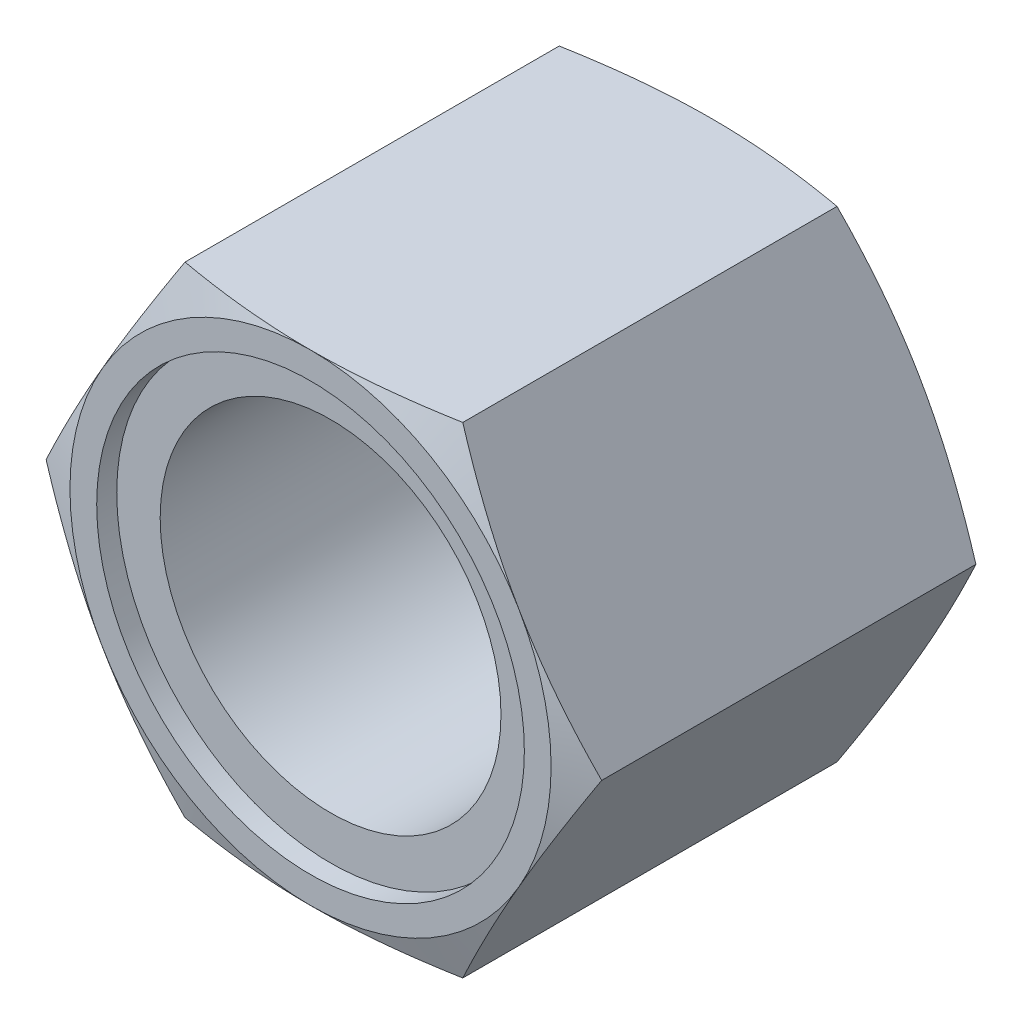
from build123d import *

# Parameters (mm, degrees)
EXTRUDE_1_DEPTH     = 30
SKETCH_2_R          = 12.75
CUT_EXTRUDE_1_DEPTH = 25
SKETCH_3_R          = 13.5
CUT_EXTRUDE_2_DEPTH = 4
SKETCH_4_R          = 16
CUT_EXTRUDE_3_DEPTH = 1.5


with BuildPart() as part:
    # Эскиз1 → Вытянуть1 (new body)
    with BuildSketch(Plane.XY):
        Polygon((10.392304845, 18), (-10.392304845, 18), (-20.784609691, 0), (-10.392304845, -18), (10.392304845, -18), (20.784609691, 0), align=None)
    extrude(amount=EXTRUDE_1_DEPTH)

    # Эскиз2 → Вырез-Вытянуть1 (cut)
    with BuildSketch(Plane.XY.offset(30)):
        Circle(SKETCH_2_R)
    extrude(amount=-CUT_EXTRUDE_1_DEPTH, mode=Mode.SUBTRACT)

    # Эскиз3 → Вырез-Вытянуть2 (cut)
    with BuildSketch(Plane.XY.offset(5)):
        Circle(SKETCH_3_R)
    extrude(amount=CUT_EXTRUDE_2_DEPTH, mode=Mode.SUBTRACT)

    # Эскиз4 → Вырез-Вытянуть3 (cut)
    with BuildSketch(Plane.XY.offset(30)):
        Circle(SKETCH_4_R)
    extrude(amount=-CUT_EXTRUDE_3_DEPTH, mode=Mode.SUBTRACT)

    # Эскиз5 → Вырез-Повернуть1 (revolve, cut)
    with BuildSketch(Plane(origin=(0, 0, 0), x_dir=(1, 0, 0), z_dir=(0, 1, 0))):
        Polygon((20.784609691, -30), (20.784609691, -29), (18, -30), align=None)
        Polygon((20.784609691, 0), (18, 0), (20.784609691, -1), align=None)
    revolve(axis=Axis((0, 0, 9), (0, 0, 1)), mode=Mode.SUBTRACT)


solid = part.part
